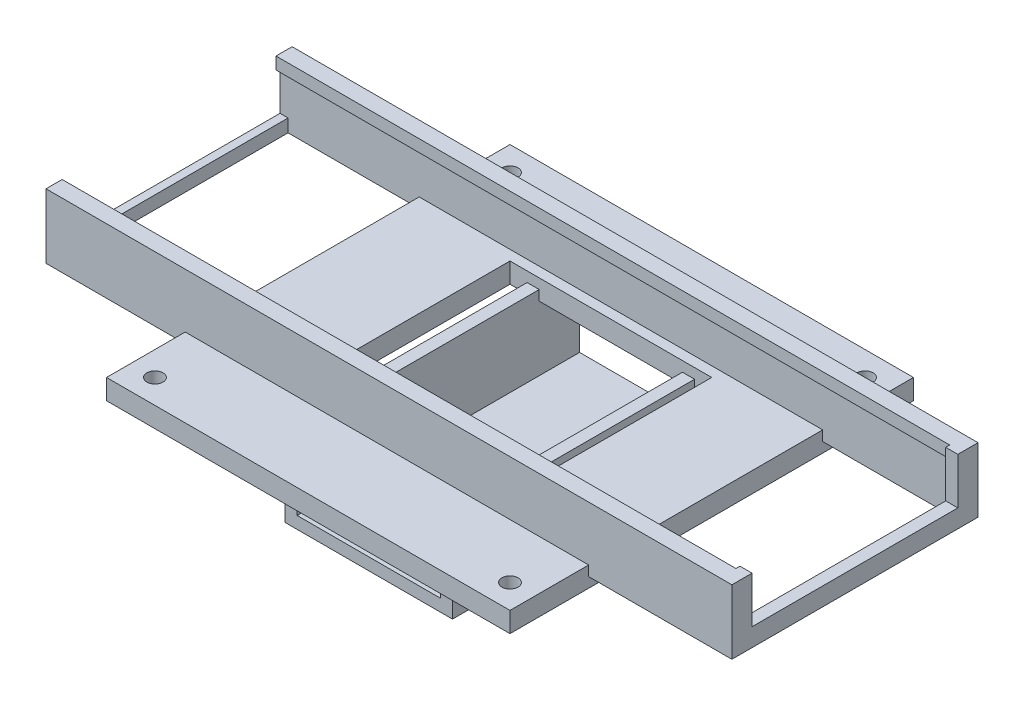
from build123d import *

# Parameters (mm, degrees)
SKETCH_2_W      = 100
SKETCH_2_H      = 100
SKETCH_2_R      = 2
SKETCH_2_W_2    = 50
SKETCH_2_H_2    = 50
EXTRUDE_1_DEPTH = 2.5
EXTRUDE_2_DEPTH = 82.5
EXTRUDE_3_DEPTH = 3
EXTRUDE_4_DEPTH = 35
EXTRUDE_5_DEPTH = 2


with BuildPart() as part:
    # 스케치2 → 보스-돌출1 (new, symmetric)
    with BuildSketch(Plane(origin=(0, 0, 0), x_dir=(1, 0, 0), z_dir=(0, 1, 0))):
        Rectangle(SKETCH_2_W, SKETCH_2_H)
        with Locations(Location((-44, 44, 0), (0, 0, 270))):
            Circle(SKETCH_2_R, mode=Mode.SUBTRACT)
        with Locations(Location((44, 44, 0), (0, 0, 270))):
            Circle(SKETCH_2_R, mode=Mode.SUBTRACT)
        with Locations(Location((-44, -44, 0), (0, 0, 270))):
            Circle(SKETCH_2_R, mode=Mode.SUBTRACT)
        with Locations(Location((44, -44, 0), (0, 0, 270))):
            Circle(SKETCH_2_R, mode=Mode.SUBTRACT)
        Rectangle(SKETCH_2_W_2, SKETCH_2_H_2, mode=Mode.SUBTRACT)
    extrude(amount=EXTRUDE_1_DEPTH, both=True)

    # 스케치3 → 보스-돌출2 (add, symmetric)
    with BuildSketch(Plane(origin=(0, 0, 0), x_dir=(0, 0, -1), z_dir=(1, 0, 0))):
        Polygon((-30.5, 0), (-30.5, 16), (-26.5, 16), (-26.5, 13), (-27.5, 13), (-27.5, 0), align=None)
        Polygon((27.5, 0), (30.5, 0), (30.5, 16), (26.5, 16), (26.5, 13), (27.5, 13), align=None)
    extrude(amount=EXTRUDE_2_DEPTH, both=True)

    # 스케치4 → 보스-돌출3 (add)
    with BuildSketch(Plane(origin=(82.5, 0, 0), x_dir=(0, 0, -1), z_dir=(1, 0, 0))):
        Polygon((-30.5, 16), (-25.5, 16), (-25.5, 4.5), (25.5, 4.5), (25.5, 16), (30.5, 16), (30.5, 0), (-30.5, 0), align=None)
    extrude(amount=EXTRUDE_3_DEPTH)

    # 스케치6 → 보스-돌출4 (add, symmetric)
    with BuildSketch(Plane.XY):
        Polygon((-20.75, 0), (-20.75, -21.5), (20.75, -21.5), (20.75, 0), (17.75, 0), (17.75, -18.5), (-17.75, -18.5), (-17.75, 0), align=None)
    extrude(amount=EXTRUDE_4_DEPTH, both=True)

    # 스케치7 → 보스-돌출5 (add)
    with BuildSketch(Plane.ZY.offset(82.5)):
        Polygon((27.5, 3.2), (-27.5, 3.2), (-27.5, 13), (-26.5, 13), (-26.5, 16), (-30.5, 16), (-30.5, 0), (30.5, 0), (30.5, 16), (26.5, 16), (26.5, 13), (27.5, 13), align=None)
    extrude(amount=EXTRUDE_5_DEPTH)


solid = part.part
